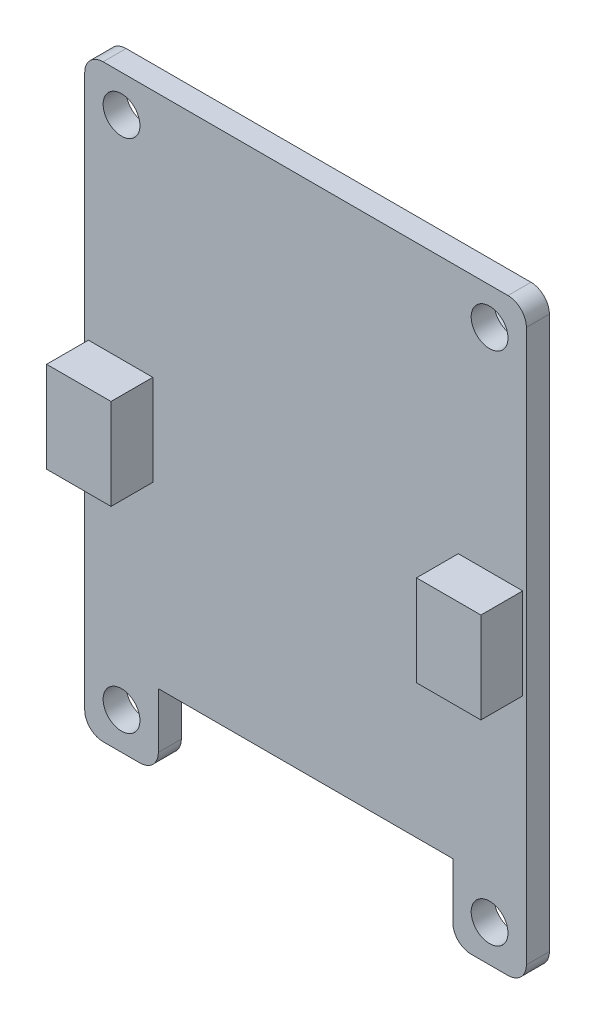
from build123d import *

# Parameters (mm, degrees)
SKETCH1_R           = 1.27
BOSS_EXTRUDE1_DEPTH = 1.5875
FILLET1_R           = 1.27
SKETCH2_W           = 25.654
SKETCH2_H           = 30.48
BOSS_EXTRUDE2_DEPTH = 2.3749
SKETCH3_W           = 4.445
SKETCH3_H           = 6.2738
BOSS_EXTRUDE3_DEPTH = 2.8829


with BuildPart() as part:
    # Sketch1 → Boss-Extrude1 (new body)
    with BuildSketch(Plane.XY):
        Polygon((-15.24, 20.32), (15.24, 20.32), (15.24, -20.32), (10.16, -20.32), (10.16, -15.24), (-10.16, -15.24), (-10.16, -20.32), (-15.24, -20.32), align=None)
        with Locations((-12.7, -17.78)):
            Circle(SKETCH1_R, mode=Mode.SUBTRACT)
        with Locations((12.7, -17.78)):
            Circle(SKETCH1_R, mode=Mode.SUBTRACT)
        with Locations((-12.7, 17.78)):
            Circle(SKETCH1_R, mode=Mode.SUBTRACT)
        with Locations((12.7, 17.78)):
            Circle(SKETCH1_R, mode=Mode.SUBTRACT)
    extrude(amount=BOSS_EXTRUDE1_DEPTH)

    # Fillet1
    fillet1_edges = [part.edges().sort_by_distance(p)[0] for p in [
        (-15.24, 20.32, 0.79375),
        (15.24, 20.32, 0.79375),
        (15.24, -20.32, 0.79375),
        (10.16, -20.32, 0.79375),
        (-10.16, -20.32, 0.79375),
        (-15.24, -20.32, 0.79375),
    ]]
    fillet(fillet1_edges, radius=FILLET1_R)

    # Sketch2 → Boss-Extrude2 (add)
    with BuildSketch(Plane(origin=(0, 0, 0), x_dir=(-1, 0, 0), z_dir=(0, 0, -1))):
        Rectangle(SKETCH2_W, SKETCH2_H)
    extrude(amount=BOSS_EXTRUDE2_DEPTH)

    # Sketch3 → Boss-Extrude3 (add)
    with BuildSketch(Plane.XY.offset(1.5875)):
        with Locations((-12.7635, 0.0381)):
            Rectangle(SKETCH3_W, SKETCH3_H)
        with Locations((12.7635, 0.0381)):
            Rectangle(SKETCH3_W, SKETCH3_H)
    extrude(amount=BOSS_EXTRUDE3_DEPTH)


solid = part.part
